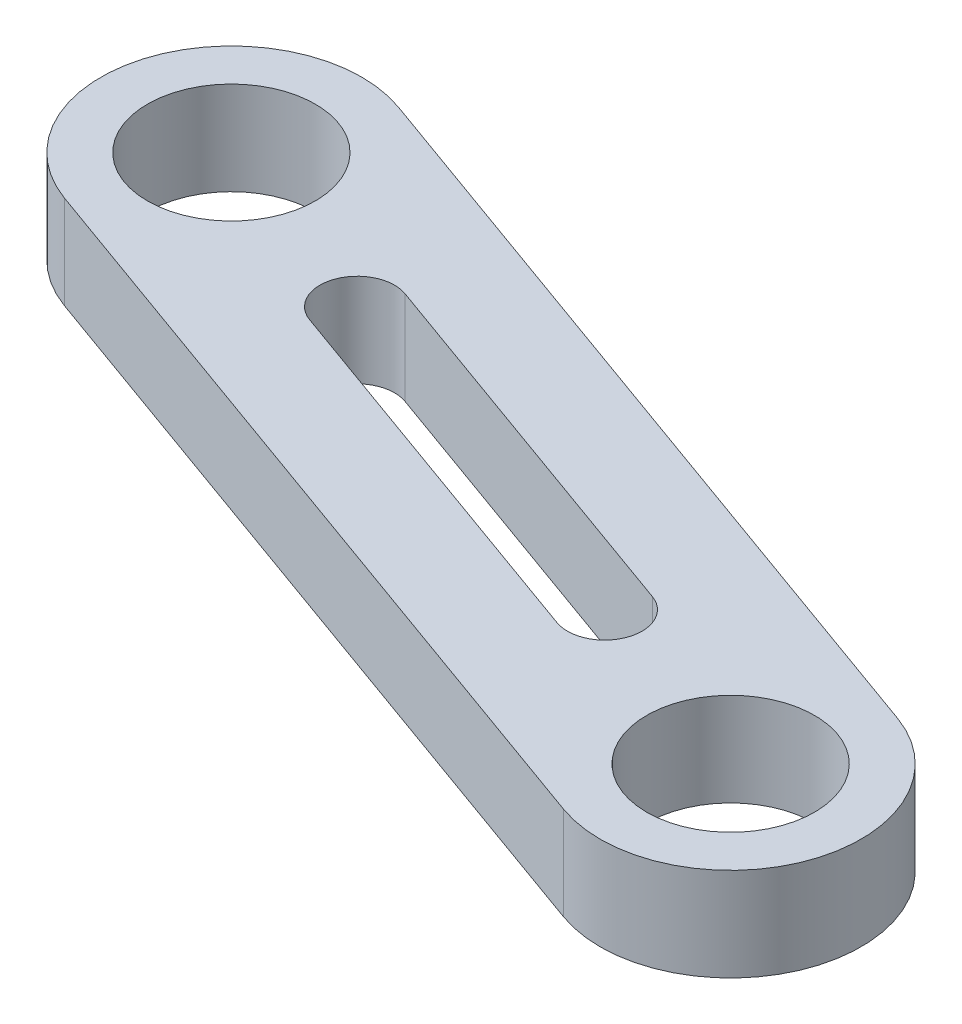
from build123d import *

# Parameters (mm, degrees)
SKETCH_1_R          = 4.5
EXTRUDE_1_DEPTH     = 5
CUT_EXTRUDE_1_DEPTH = 10


with BuildPart() as part:
    # 草图1 → 凸台-拉伸1 (new body)
    with BuildSketch(Plane(origin=(0, 0, 0), x_dir=(1, 0, 0), z_dir=(0, 1, 0))):
        with BuildLine():
            Line((-39.403034963, -93.411939556), (2.365895093, -108.411939556))
            ThreePointArc((2.365895093, -108.411939556), (6.588060444, -117.365895093), (-2.365895093, -121.588060444))
            Line((-2.365895093, -121.588060444), (-44.134825149, -106.588060444))
            ThreePointArc((-44.134825149, -106.588060444), (-48.356990499, -97.634104907), (-39.403034963, -93.411939556))
        make_face()
        with Locations(Location((-41.768930056, -100, 0), (0, 0, 270))):
            Circle(SKETCH_1_R, mode=Mode.SUBTRACT)
        with Locations(Location((0, -115, 0), (0, 0, 270))):
            Circle(SKETCH_1_R, mode=Mode.SUBTRACT)
    extrude(amount=EXTRUDE_1_DEPTH)

    # 草图2 → 切除-拉伸1 (cut)
    with BuildSketch(Plane(origin=(0, 5, 0), x_dir=(1, 0, 0), z_dir=(0, 1, 0))):
        with BuildLine():
            Line((-30.561161413, -101.89986187), (-9.85582859, -109.335532162))
            ThreePointArc((-9.85582859, -109.335532162), (-8.649495632, -111.893805173), (-11.207768643, -113.10013813))
            Line((-11.207768643, -113.10013813), (-31.913101466, -105.664467838))
            ThreePointArc((-31.913101466, -105.664467838), (-33.119434423, -103.106194827), (-30.561161413, -101.89986187))
        make_face()
    extrude(amount=-CUT_EXTRUDE_1_DEPTH, mode=Mode.SUBTRACT)


solid = part.part
